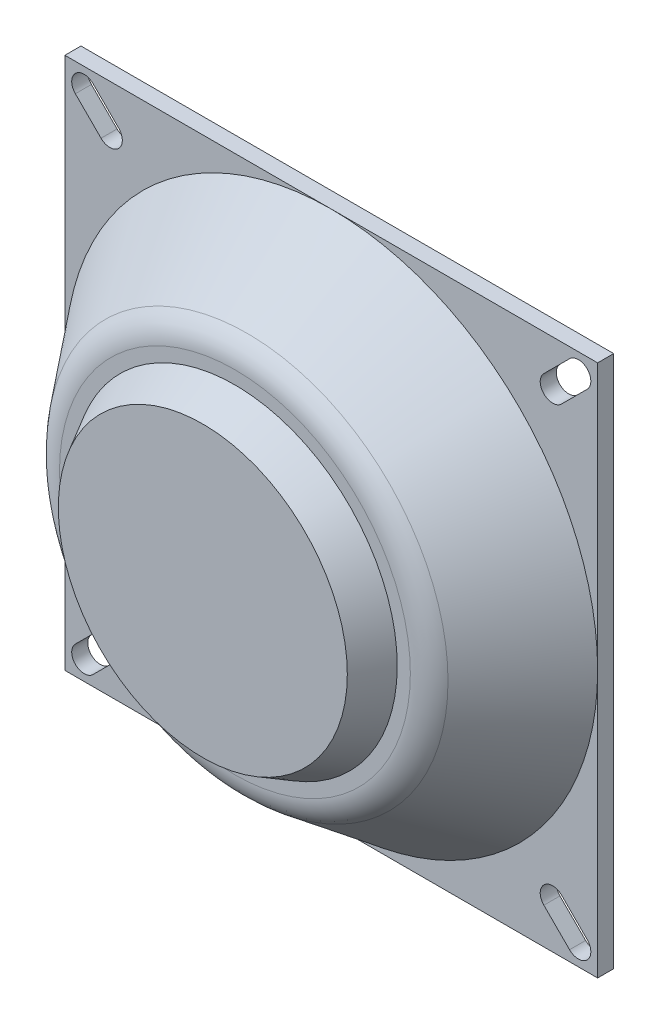
from build123d import *

# Parameters (mm, degrees)
SKETCH4_R           = 45
BOSS_EXTRUDE1_DEPTH = 10
BOSS_EXTRUDE1_DRAFT = 29
SKETCH7_R           = 59.508676161
BOSS_EXTRUDE2_DEPTH = 30
BOSS_EXTRUDE2_DRAFT = 38
FILLET1_R           = 10
SKETCH9_W           = 165.894489912
SKETCH9_H           = 165.894489912
BOSS_EXTRUDE3_DEPTH = 5


with BuildPart() as part:
    # Sketch4 → Boss-Extrude1 (with draft: the straight prism first)
    with BuildSketch(Plane.XY):
        with Locations((-305.359774759, 116.794851209)):
            Circle(SKETCH4_R)
    extrude(amount=-BOSS_EXTRUDE1_DEPTH)
    # Boss-Extrude1: the draft: its side faces are tilted about the plane it starts from
    boss_extrude1_sides = [part.faces().sort_by_distance(p)[0] for p in [
        (-350.359774759, 116.794851209, -5),
    ]]
    draft(boss_extrude1_sides, Plane.XY, BOSS_EXTRUDE1_DRAFT)


with BuildPart() as boss_extrude2_tool:
    # Sketch7 → Boss-Extrude2 (with draft: the straight prism first)
    with BuildSketch(Plane.XY.offset(-10)):
        with Locations((-305.359774759, 116.794851209)):
            Circle(SKETCH7_R)
    extrude(amount=-BOSS_EXTRUDE2_DEPTH)
    # Boss-Extrude2: the draft: its side faces are tilted about the plane it starts from
    boss_extrude2_sides = [boss_extrude2_tool.faces().sort_by_distance(p)[0] for p in [
        (-364.868450919, 116.794851209, -25),
    ]]
    draft(boss_extrude2_sides, Plane.XY.offset(-10), BOSS_EXTRUDE2_DRAFT)


with BuildPart() as part_1:
    add(part.part)

    # Boss-Extrude2: add boss_extrude2_tool
    add(boss_extrude2_tool.part)

    # Fillet1
    fillet1_edges = [part_1.edges().sort_by_distance(p)[0] for p in [
        (-364.868450919, 116.794851209, -10),
    ]]
    fillet(fillet1_edges, radius=FILLET1_R)

    # Sketch9 → Boss-Extrude3 (add)
    with BuildSketch(Plane.XY.offset(-40)):
        with Locations((-305.359774759, 116.794851209)):
            Rectangle(SKETCH9_W, SKETCH9_H)
        with BuildLine():
            Line((-225.670814758, 191.00038112), (-233.670814758, 183.00038112))
            ThreePointArc((-233.670814758, 183.00038112), (-239.154244847, 183.00038112), (-239.154244847, 188.48381121))
            Line((-239.154244847, 188.48381121), (-231.154244847, 196.48381121))
            ThreePointArc((-231.154244847, 196.48381121), (-225.670814758, 196.48381121), (-225.670814758, 191.00038112))
        make_face(mode=Mode.SUBTRACT)
        with BuildLine():
            Line((-385.048734759, 191.00038112), (-377.048734759, 183.00038112))
            ThreePointArc((-377.048734759, 183.00038112), (-371.56530467, 183.00038112), (-371.56530467, 188.48381121))
            Line((-371.56530467, 188.48381121), (-379.56530467, 196.48381121))
            ThreePointArc((-379.56530467, 196.48381121), (-385.048734759, 196.48381121), (-385.048734759, 191.00038112))
        make_face(mode=Mode.SUBTRACT)
        with BuildLine():
            Line((-385.048734759, 42.589321298), (-377.048734759, 50.589321298))
            ThreePointArc((-377.048734759, 50.589321298), (-371.56530467, 50.589321298), (-371.56530467, 45.105891208))
            Line((-371.56530467, 45.105891208), (-379.56530467, 37.105891208))
            ThreePointArc((-379.56530467, 37.105891208), (-385.048734759, 37.105891208), (-385.048734759, 42.589321298))
        make_face(mode=Mode.SUBTRACT)
        with BuildLine():
            Line((-225.670814758, 42.589321298), (-233.670814758, 50.589321298))
            ThreePointArc((-233.670814758, 50.589321298), (-239.154244847, 50.589321298), (-239.154244847, 45.105891208))
            Line((-239.154244847, 45.105891208), (-231.154244847, 37.105891208))
            ThreePointArc((-231.154244847, 37.105891208), (-225.670814758, 37.105891208), (-225.670814758, 42.589321298))
        make_face(mode=Mode.SUBTRACT)
    extrude(amount=-BOSS_EXTRUDE3_DEPTH)


solid = part_1.part
